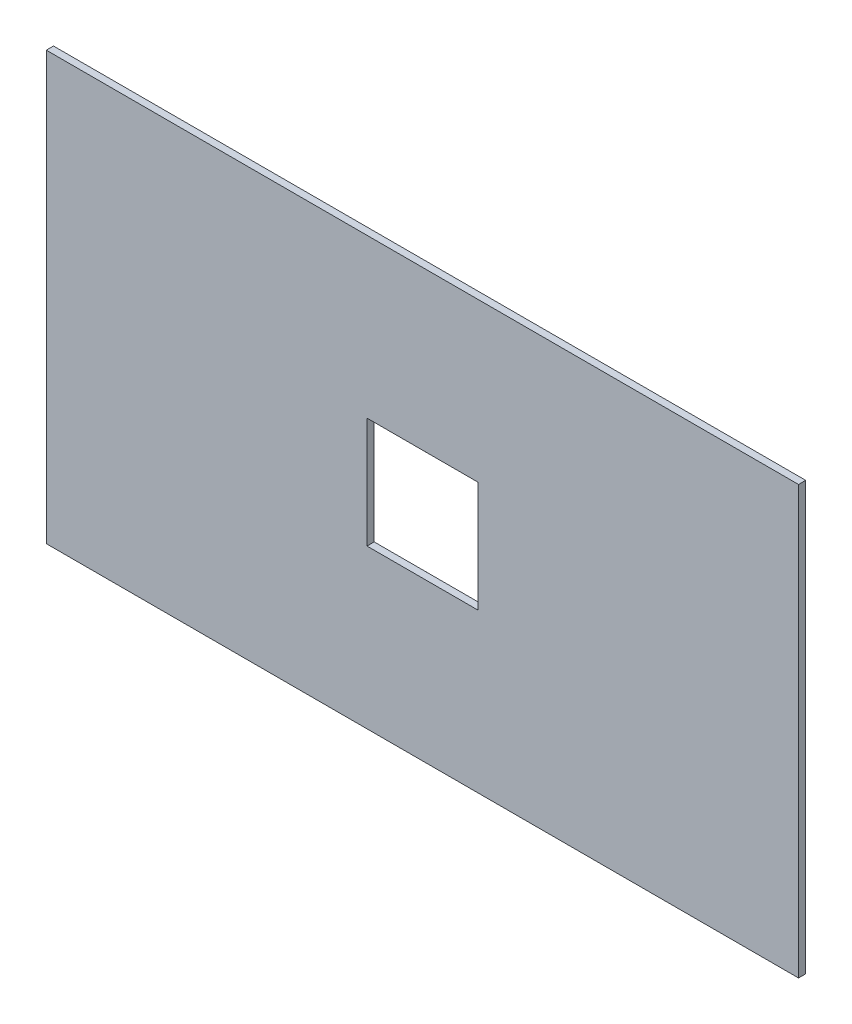
from build123d import *

# Parameters (mm, degrees)
SKETCH1_W           = 279.4
SKETCH1_H           = 158.75
BOSS_EXTRUDE1_DEPTH = 2.667
SKETCH2_W           = 41.148
SKETCH2_H           = 41.148
CUT_EXTRUDE1_DEPTH  = 47.752


with BuildPart() as part:
    # Sketch1 → Boss-Extrude1 (new body)
    with BuildSketch(Plane.XY):
        Rectangle(SKETCH1_W, SKETCH1_H)
    extrude(amount=BOSS_EXTRUDE1_DEPTH)

    # Sketch2 → Cut-Extrude1 (cut)
    with BuildSketch(Plane.XY):
        Rectangle(SKETCH2_W, SKETCH2_H)
    extrude(amount=CUT_EXTRUDE1_DEPTH, mode=Mode.SUBTRACT)


solid = part.part
